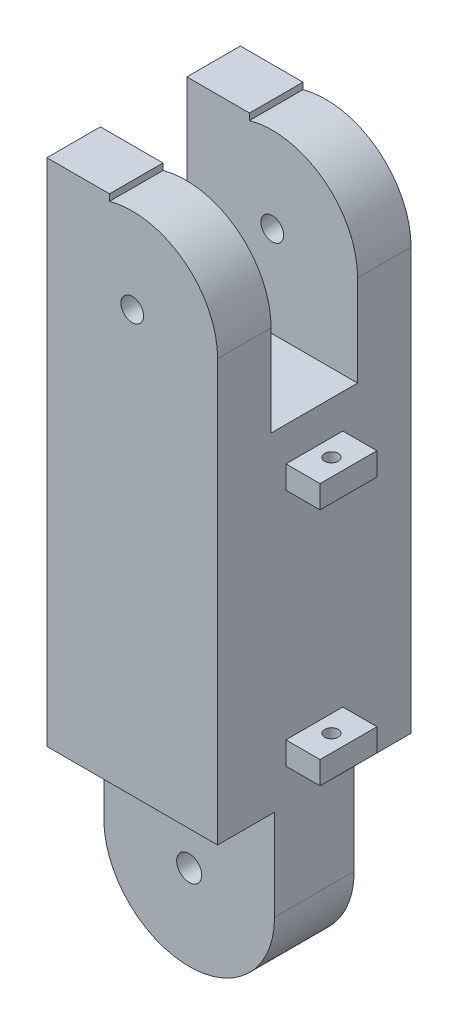
from build123d import *

# Parameters (mm, degrees)
LINK1_BODY_DEPTH       = 8.5
TONGUE_CUT_DEPTH       = 56.258483512
TONGUE_CUT_DEPTH_BACK  = 56.258483512
SKETCH1_W              = 5.5
SKETCH1_H              = 15.998130079
SKETCH7_W              = 5.5
SKETCH7_H              = 7.8
BOSS_EXTRUDE1_DEPTH    = 8.5
SLOT_CUT_DEPTH         = 55.003148056
SLOT_CUT_DEPTH_BACK    = 55.003148056
SKETCH2_W              = 7.6
SKETCH2_H              = 18
PIN_HOLES_DEPTH        = 55.003148056
PIN_HOLES_DEPTH_BACK   = 55.003148056
SKETCH3_R              = 1.1
SKETCH3_R_2            = 1
SKETCH4_W              = 3.5
SKETCH4_H              = 2
GUIDE_BLOCK_1_DEPTH    = 2.5
SKETCH5_W              = 3.5
SKETCH5_H              = 2
GUIDE_BLOCK_2_DEPTH    = 2.5
CORD_GUIDES_DEPTH      = 55.500938464
CORD_GUIDES_DEPTH_BACK = 55.500938464
SKETCH6_R              = 0.6


with BuildPart() as part:
    # Link1_Outline → Link1_Body (new, symmetric)
    with BuildSketch(Plane.XY):
        with BuildLine():
            Line((-7.5, 0), (-7.5, 45))
            ThreePointArc((-7.5, 45), (0, 52.5), (7.5, 45))
            Line((7.5, 45), (7.5, 0))
            ThreePointArc((7.5, 0), (0, -7.5), (-7.5, 0))
        make_face()
    extrude(amount=LINK1_BODY_DEPTH, both=True)

    # Sketch1 → Tongue_Cut (cut, two sides: drawn at the far end of the back side and taken through both)
    with BuildSketch(Plane(origin=(7.5, 0, 0), x_dir=(0, 0, -1), z_dir=(1, 0, 0)).offset(-TONGUE_CUT_DEPTH_BACK)):
        with Locations((6.25, -0.00093496)):
            Rectangle(SKETCH1_W, SKETCH1_H)
        with Locations((-6.25, -0.00093496)):
            Rectangle(SKETCH1_W, SKETCH1_H)
    extrude(amount=TONGUE_CUT_DEPTH + TONGUE_CUT_DEPTH_BACK, mode=Mode.SUBTRACT)

    # Sketch7 → Boss-Extrude1 (add, symmetric)
    with BuildSketch(Plane.XY):
        with Locations((-4.75, 48.9)):
            Rectangle(SKETCH7_W, SKETCH7_H)
    extrude(amount=BOSS_EXTRUDE1_DEPTH, both=True)

    # Sketch2 → Slot_Cut (cut, two sides: drawn at the far end of the back side and taken through both)
    with BuildSketch(Plane(origin=(0, 0, 0), x_dir=(0, 0, -1), z_dir=(1, 0, 0)).offset(-SLOT_CUT_DEPTH_BACK)):
        with Locations((0, 46)):
            Rectangle(SKETCH2_W, SKETCH2_H)
    extrude(amount=SLOT_CUT_DEPTH + SLOT_CUT_DEPTH_BACK, mode=Mode.SUBTRACT)

    # Sketch3 → Pin_Holes (cut, two sides: drawn at the far end of the back side and taken through both)
    with BuildSketch(Plane.XY.offset(-PIN_HOLES_DEPTH_BACK)):
        Circle(SKETCH3_R)
        with Locations((0, 45)):
            Circle(SKETCH3_R_2)
    extrude(amount=PIN_HOLES_DEPTH + PIN_HOLES_DEPTH_BACK, mode=Mode.SUBTRACT)

    # Sketch4 → Guide_Block_1 (add, symmetric)
    with BuildSketch(Plane.XY):
        with Locations((8.75, 12)):
            Rectangle(SKETCH4_W, SKETCH4_H)
    extrude(amount=GUIDE_BLOCK_1_DEPTH, both=True)

    # Sketch5 → Guide_Block_2 (add, symmetric)
    with BuildSketch(Plane.XY):
        with Locations((8.750585387, 33)):
            Rectangle(SKETCH5_W, SKETCH5_H)
    extrude(amount=GUIDE_BLOCK_2_DEPTH, both=True)

    # Sketch6 → Cord_Guides (cut, two sides: drawn at the far end of the back side and taken through both)
    with BuildSketch(Plane(origin=(0, 0, 0), x_dir=(1, 0, 0), z_dir=(0, 1, 0)).offset(-CORD_GUIDES_DEPTH_BACK)):
        with Locations(Location((9, 0, 0), (0, 0, 90))):
            Circle(SKETCH6_R)
    extrude(amount=CORD_GUIDES_DEPTH + CORD_GUIDES_DEPTH_BACK, mode=Mode.SUBTRACT)


solid = part.part
